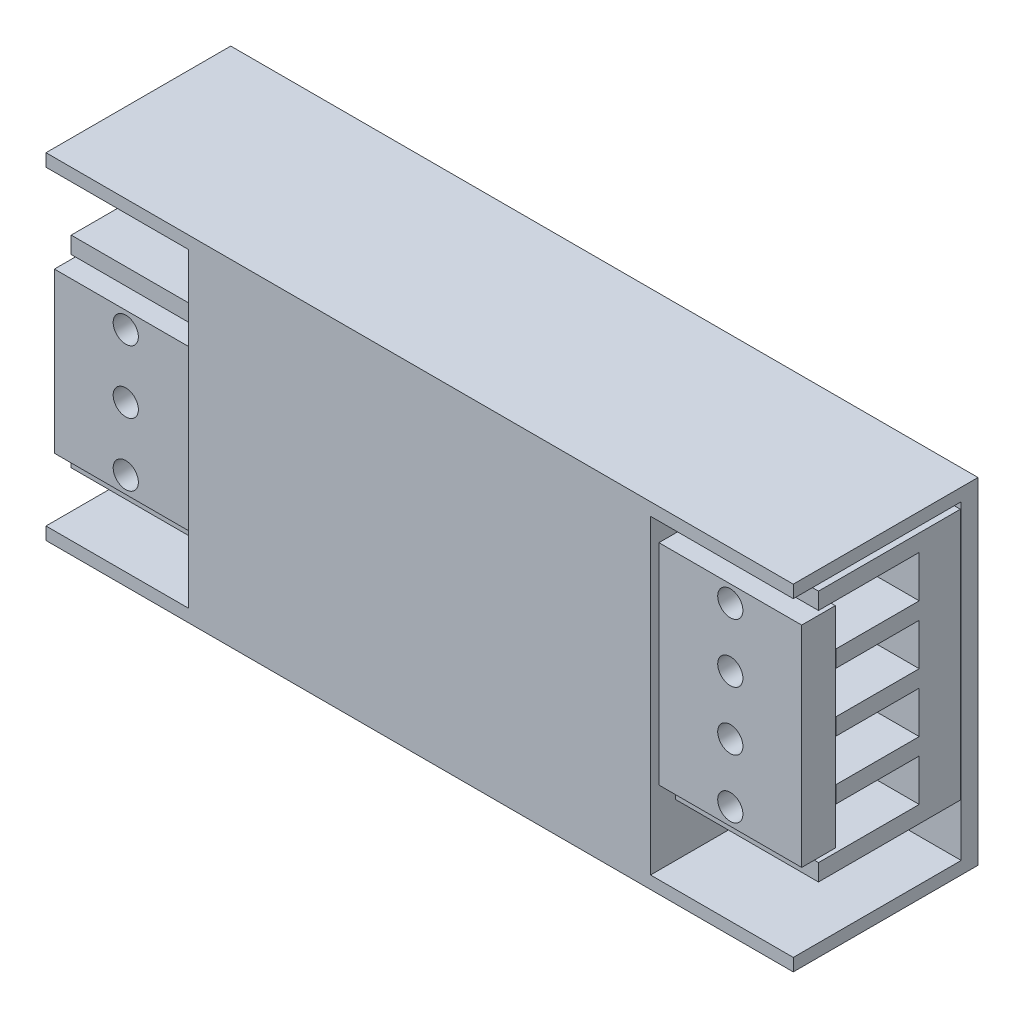
from build123d import *

# Parameters (mm, degrees)
SKETCH1_W                 = 89
SKETCH1_H                 = 40
BOSS_EXTRUDE1_DEPTH       = 22
SKETCH2_W                 = 17
SKETCH2_H                 = 37
CUT_EXTRUDE1_DEPTH        = 20
SKETCH3_W                 = 17
SKETCH3_H                 = 2
BOSS_EXTRUDE2_DEPTH       = 17
BOSS_EXTRUDE10_DEPTH      = 2
BOSS_EXTRUDE10_DEPTH_BACK = 2
SKETCH4_W                 = 17
SKETCH4_H                 = 19
SKETCH4_R                 = 1.5
SKETCH5_W                 = 17
SKETCH5_H                 = 2
BOSS_EXTRUDE11_DEPTH      = 17
BOSS_EXTRUDE13_DEPTH      = 2
BOSS_EXTRUDE13_DEPTH_BACK = 2
SKETCH6_W                 = 17
SKETCH6_H                 = 25
SKETCH6_R                 = 1.5
SKETCH7_W                 = 0.1
SKETCH7_H                 = 2
CUT_EXTRUDE2_DEPTH        = 17
SKETCH8_W                 = 0.1
SKETCH8_H                 = 2
CUT_EXTRUDE11_DEPTH       = 17
SKETCH10_W                = 17
SKETCH10_H                = 5
SKETCH10_H_2              = 6
BOSS_EXTRUDE14_DEPTH      = 5
SKETCH11_W                = 0.1
SKETCH11_H                = 20
CUT_EXTRUDE12_DEPTH       = 17
SKETCH12_W                = 17
SKETCH12_H                = 5
BOSS_EXTRUDE15_DEPTH      = 5
SKETCH13_W                = 0.1
SKETCH13_H                = 26
CUT_EXTRUDE13_DEPTH       = 17


with BuildPart() as part:
    # Sketch1 → Boss-Extrude1 (new body)
    with BuildSketch(Plane.XY):
        Rectangle(SKETCH1_W, SKETCH1_H)
    extrude(amount=BOSS_EXTRUDE1_DEPTH)

    # Sketch2 → Cut-Extrude1 (cut)
    with BuildSketch(Plane.XY.offset(22)):
        with Locations((-36, 0)):
            Rectangle(SKETCH2_W, SKETCH2_H)
        with Locations((36, 0)):
            Rectangle(SKETCH2_W, SKETCH2_H)
    extrude(amount=-CUT_EXTRUDE1_DEPTH, mode=Mode.SUBTRACT)

    # Sketch3 → Boss-Extrude2 (add)
    with BuildSketch(Plane.XY.offset(2)):
        with Locations((-36, 9)):
            Rectangle(SKETCH3_W, SKETCH3_H)
        with Locations((-36, 2)):
            Rectangle(SKETCH3_W, SKETCH3_H)
        with Locations((-36, -6)):
            Rectangle(SKETCH3_W, SKETCH3_H)
        with Locations((-36, -13)):
            Rectangle(SKETCH3_W, SKETCH3_H)
    extrude(amount=BOSS_EXTRUDE2_DEPTH)

    # Sketch4 → Boss-Extrude10 (add, two sides: drawn at the far end of the back side and taken through both)
    with BuildSketch(Plane.XY.offset(19).offset(-BOSS_EXTRUDE10_DEPTH_BACK)):
        with Locations((-36, -2)):
            Rectangle(SKETCH4_W, SKETCH4_H)
        with Locations((-36, 5.5)):
            Circle(SKETCH4_R, mode=Mode.SUBTRACT)
        with Locations((-36, -2)):
            Circle(SKETCH4_R, mode=Mode.SUBTRACT)
        with Locations((-36, -9.5)):
            Circle(SKETCH4_R, mode=Mode.SUBTRACT)
    extrude(amount=BOSS_EXTRUDE10_DEPTH + BOSS_EXTRUDE10_DEPTH_BACK)

    # Sketch5 → Boss-Extrude11 (add)
    with BuildSketch(Plane.XY.offset(2)):
        with Locations((36, 16.778017119)):
            Rectangle(SKETCH5_W, SKETCH5_H)
        with Locations((36, 9.778017119)):
            Rectangle(SKETCH5_W, SKETCH5_H)
        with Locations((36, 2.778017119)):
            Rectangle(SKETCH5_W, SKETCH5_H)
        with Locations((36, -4.221982881)):
            Rectangle(SKETCH5_W, SKETCH5_H)
        with Locations((36, -11.221982881)):
            Rectangle(SKETCH5_W, SKETCH5_H)
    extrude(amount=BOSS_EXTRUDE11_DEPTH)

    # Sketch6 → Boss-Extrude13 (add, two sides: drawn at the far end of the back side and taken through both)
    with BuildSketch(Plane.XY.offset(19).offset(-BOSS_EXTRUDE13_DEPTH_BACK)):
        with Locations((36, 2.778017119)):
            Rectangle(SKETCH6_W, SKETCH6_H)
        with Locations((36, 13.278017119)):
            Circle(SKETCH6_R, mode=Mode.SUBTRACT)
        with Locations((36, 6.278017119)):
            Circle(SKETCH6_R, mode=Mode.SUBTRACT)
        with Locations((36, -0.721982881)):
            Circle(SKETCH6_R, mode=Mode.SUBTRACT)
        with Locations((36, -7.721982881)):
            Circle(SKETCH6_R, mode=Mode.SUBTRACT)
    extrude(amount=BOSS_EXTRUDE13_DEPTH + BOSS_EXTRUDE13_DEPTH_BACK)

    # Sketch7 → Cut-Extrude2 (cut)
    with BuildSketch(Plane.ZY.offset(44.5)):
        with Locations((2.05, 9)):
            Rectangle(SKETCH7_W, SKETCH7_H)
        with Locations((2.05, 2)):
            Rectangle(SKETCH7_W, SKETCH7_H)
        with Locations((2.05, -6)):
            Rectangle(SKETCH7_W, SKETCH7_H)
        with Locations((2.05, -13)):
            Rectangle(SKETCH7_W, SKETCH7_H)
        with Locations((16.95, -6)):
            Rectangle(SKETCH7_W, SKETCH7_H)
        with Locations((16.95, 2)):
            Rectangle(SKETCH7_W, SKETCH7_H)
    extrude(amount=-CUT_EXTRUDE2_DEPTH, mode=Mode.SUBTRACT)

    # Sketch8 → Cut-Extrude11 (cut)
    with BuildSketch(Plane(origin=(44.5, 0, 0), x_dir=(0, 0, -1), z_dir=(1, 0, 0))):
        with Locations((-2.05, -4.221982881)):
            Rectangle(SKETCH8_W, SKETCH8_H)
        with Locations((-16.95, -4.221982881)):
            Rectangle(SKETCH8_W, SKETCH8_H)
        with Locations((-16.95, 2.778017119)):
            Rectangle(SKETCH8_W, SKETCH8_H)
        with Locations((-16.95, 9.778017119)):
            Rectangle(SKETCH8_W, SKETCH8_H)
        with Locations((-2.05, 16.778017119)):
            Rectangle(SKETCH8_W, SKETCH8_H)
        with Locations((-2.05, 9.778017119)):
            Rectangle(SKETCH8_W, SKETCH8_H)
        with Locations((-2.05, 2.778017119)):
            Rectangle(SKETCH8_W, SKETCH8_H)
        with Locations((-2.05, -11.221982881)):
            Rectangle(SKETCH8_W, SKETCH8_H)
    extrude(amount=-CUT_EXTRUDE11_DEPTH, mode=Mode.SUBTRACT)

    # Sketch10 → Boss-Extrude14 (add)
    with BuildSketch(Plane.XY.offset(2)):
        with Locations((-36, 5.5)):
            Rectangle(SKETCH10_W, SKETCH10_H)
        with Locations((-36, -2)):
            Rectangle(SKETCH10_W, SKETCH10_H_2)
        with Locations((-36, -9.5)):
            Rectangle(SKETCH10_W, SKETCH10_H)
    extrude(amount=BOSS_EXTRUDE14_DEPTH)

    # Sketch11 → Cut-Extrude12 (cut)
    with BuildSketch(Plane.ZY.offset(44.5)):
        with Locations((2.05, -2)):
            Rectangle(SKETCH11_W, SKETCH11_H)
    extrude(amount=-CUT_EXTRUDE12_DEPTH, mode=Mode.SUBTRACT)

    # Sketch12 → Boss-Extrude15 (add)
    with BuildSketch(Plane.XY.offset(2)):
        with Locations((36, 13.278017119)):
            Rectangle(SKETCH12_W, SKETCH12_H)
        with Locations((36, 6.278017119)):
            Rectangle(SKETCH12_W, SKETCH12_H)
        with Locations((36, -0.721982881)):
            Rectangle(SKETCH12_W, SKETCH12_H)
        with Locations((36, -7.721982881)):
            Rectangle(SKETCH12_W, SKETCH12_H)
    extrude(amount=BOSS_EXTRUDE15_DEPTH)

    # Sketch13 → Cut-Extrude13 (cut)
    with BuildSketch(Plane(origin=(44.5, 0, 0), x_dir=(0, 0, -1), z_dir=(1, 0, 0))):
        with Locations((-2.05, 2.778017119)):
            Rectangle(SKETCH13_W, SKETCH13_H)
    extrude(amount=-CUT_EXTRUDE13_DEPTH, mode=Mode.SUBTRACT)


solid = part.part
